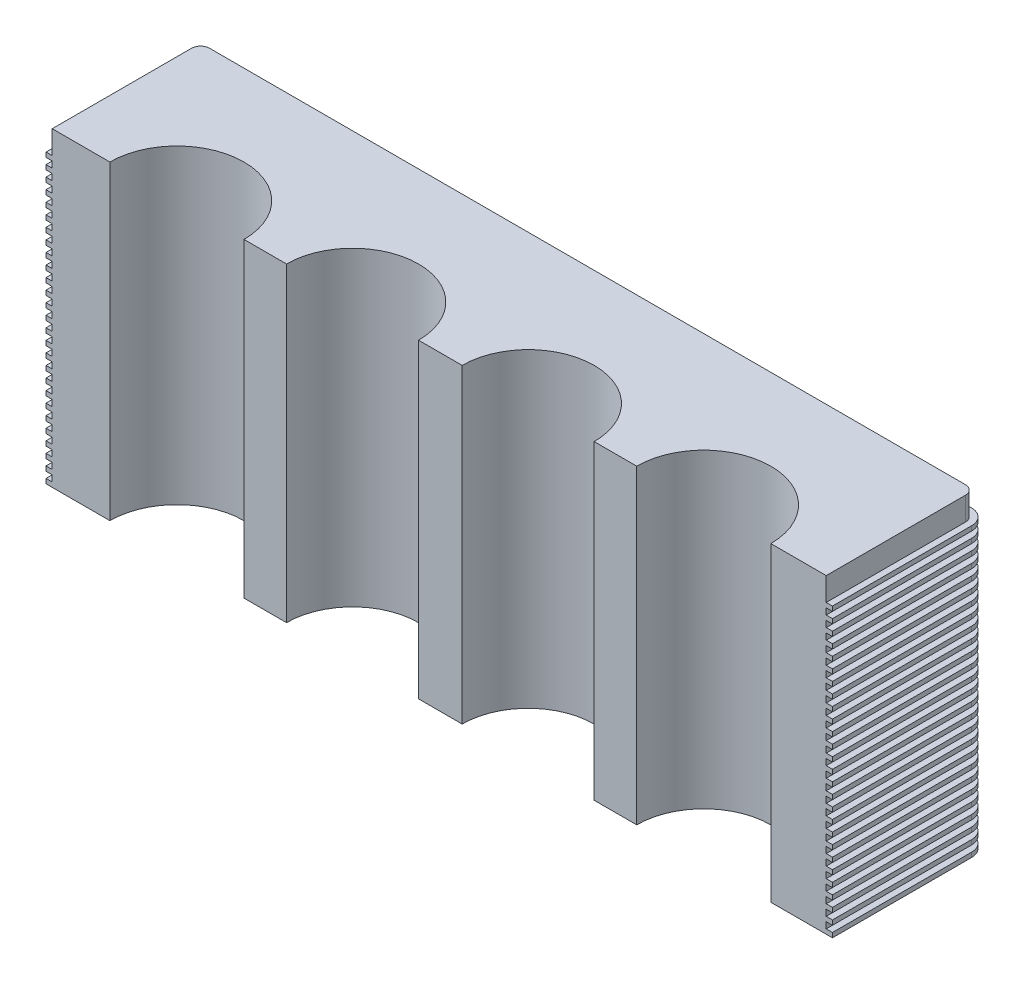
from build123d import *

# Parameters (mm, degrees)
BOSS_EXTRUDE3_DEPTH = 200
BOSS_EXTRUDE4_DEPTH = 3
LPATTERN1_COUNT     = 27
LPATTERN1_PITCH     = 7


with BuildPart() as part:
    # Sketch2 → Boss-Extrude3 (new body)
    with BuildSketch(Plane(origin=(0, 0, 0), x_dir=(1, 0, 0), z_dir=(0, 1, 0))):
        with BuildLine():
            Line((0, 0), (37.12205366, 0))
            ThreePointArc((37.12205366, 0), (80.293819868, 43.171766207), (123.465586075, 0))
            Line((123.465586075, 0), (150.841626896, 0))
            ThreePointArc((150.841626896, 0), (193.341626896, 42.5), (235.841626896, 0))
            Line((235.841626896, 0), (249.88116365, 0))
            Line((249.88116365, 0), (263.920700404, 0))
            ThreePointArc((263.920700404, 0), (306.420700404, 42.5), (348.920700404, 0))
            Line((348.920700404, 0), (376.296741225, 0))
            ThreePointArc((376.296741225, 0), (419.468507432, 43.171766207), (462.640273639, 0))
            Line((462.640273639, 0), (498.326679335, 0))
            Line((498.326679335, 0), (498.326679335, 89.656456371))
            ThreePointArc((498.326679335, 89.656456371), (496.614783814, 93.789337756), (492.481902429, 95.501233277))
            Line((492.481902429, 95.501233277), (5.844776906, 95.501233277))
            ThreePointArc((5.844776906, 95.501233277), (1.711895521, 93.789337756), (0, 89.656456371))
            Line((0, 89.656456371), (0, 0))
        make_face()
    extrude(amount=BOSS_EXTRUDE3_DEPTH)

    # Sketch5 → Boss-Extrude4 (add)
    with BuildSketch(Plane(origin=(0, 0, 0), x_dir=(1, 0, 0), z_dir=(0, 1, 0))):
        with BuildLine():
            Line((502.326679335, 0), (502.326679335, 89.656456371))
            ThreePointArc((502.326679335, 89.656456371), (499.443210938, 96.61776488), (492.481902429, 99.501233277))
            Line((492.481902429, 99.501233277), (5.844776906, 99.501233277))
            ThreePointArc((5.844776906, 99.501233277), (-1.116531604, 96.61776488), (-4, 89.656456371))
            Line((-4, 89.656456371), (-4, 0))
            Line((-4, 0), (0, 0))
            Line((0, 0), (0, 89.656456371))
            ThreePointArc((0, 89.656456371), (1.711895521, 93.789337756), (5.844776906, 95.501233277))
            Line((5.844776906, 95.501233277), (492.481902429, 95.501233277))
            ThreePointArc((492.481902429, 95.501233277), (496.614783814, 93.789337756), (498.326679335, 89.656456371))
            Line((498.326679335, 89.656456371), (498.326679335, 0))
            Line((498.326679335, 0), (502.326679335, 0))
        make_face()
    boss_extrude4 = extrude(amount=BOSS_EXTRUDE4_DEPTH)

    # LPattern1: Boss-Extrude4 ×27
    with Locations(*[(0, i * LPATTERN1_PITCH, 0) for i in range(1, LPATTERN1_COUNT)]):
        add(boss_extrude4)


solid = part.part
